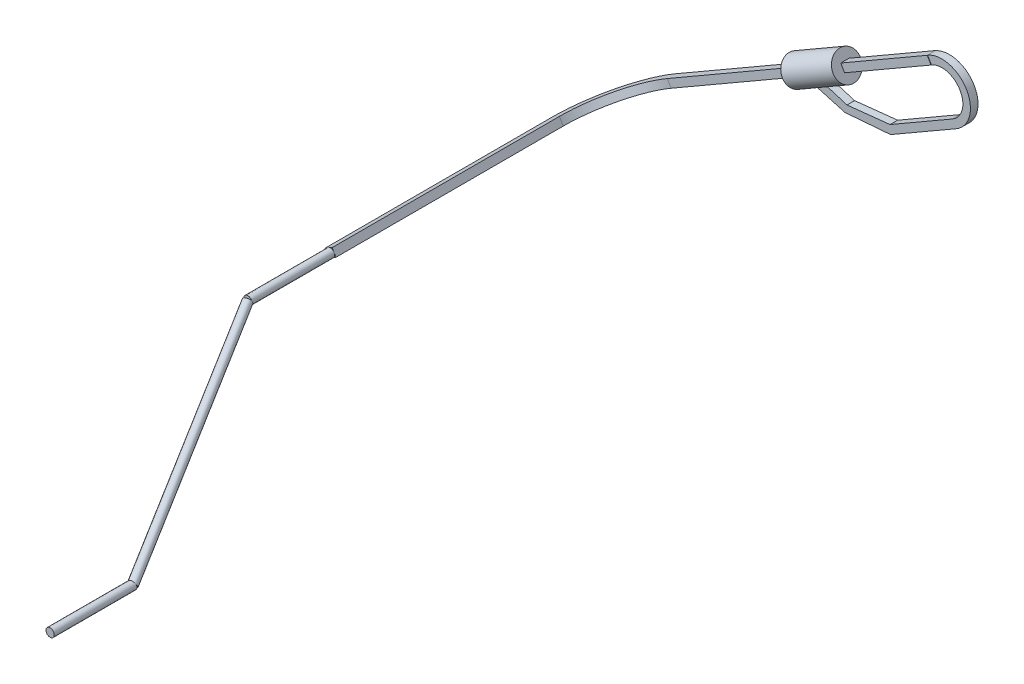
from build123d import *

# Parameters (mm, degrees)
S01_TENDON_CAPTIVE_TAIL_R                      = 0.6
F_01_TENDON_CAPTIVE_TAIL_DEPTH                 = 12
S02_CROSSED_TENDON_R                           = 0.6
F_02_CROSSED_TENDON_DEPTH                      = 33.010681761
S03_TENDON_THROUGH_REAR_GROMMET_R              = 0.6
F_03_TENDON_THROUGH_REAR_GROMMET_DEPTH         = 12
F_04_START                                     = -0.55
F_04_TENDON_RETURN_DEPTH                       = 1.1
F_05_START                                     = 0.55
F_05_REMOVABLE_BACKED_EYE_AROUND_POLISHE_DEPTH = 1.1
S06_DRESSED_EYE_KNOT_ENVELOPE_R                = 2
F_06_DRESSED_EYE_KNOT_ENVELOPE_DEPTH           = 8.5


with BuildPart() as part:
    # S01 - Tendon captive tail → 01 - Tendon captive tail (new body)
    with BuildSketch(Plane.XY.offset(25.959868809)):
        with Locations((9.23492213, 11.820161304)):
            Circle(S01_TENDON_CAPTIVE_TAIL_R)
    extrude(amount=F_01_TENDON_CAPTIVE_TAIL_DEPTH)

    # S02 - Crossed tendon → 02 - Crossed tendon (add)
    with BuildSketch(Plane(origin=(-4.622059485, 9.098971782, -12.992860813), x_dir=(0.9600712579884836, 0.16047626486622726, -0.2291518012126354), z_dir=(0.2797555711409706, -0.5507259385721964, 0.7864081389452696))):
        with Locations(Location((4.814287946, 24.573430328, 0), (0, 0, 21.775546522))):
            Circle(S02_CROSSED_TENDON_R)
    extrude(amount=F_02_CROSSED_TENDON_DEPTH)

    # S03 - Tendon through rear grommet → 03 - Tendon through rear grommet (add)
    with BuildSketch(Plane.XY.offset(-12)):
        with Locations(Location((0, 30, 0), (0, 0, 206.929477468))):
            Circle(S03_TENDON_THROUGH_REAR_GROMMET_R)
    extrude(amount=F_03_TENDON_THROUGH_REAR_GROMMET_DEPTH)

    # S04 - Tendon return → 04 - Tendon return (add)
    with BuildSketch(Plane(origin=(-12.990381057, 22.5, 0), x_dir=(-0.8660254037844386, -0.5000000000000001, 0), z_dir=(0.5000000000000001, -0.8660254037844386, 0)).offset(F_04_START)):
        with BuildLine():
            Line((-14.4, 12), (-14.4, 45))
            ThreePointArc((-14.4, 45), (-17.211774901, 51.788225099), (-24, 54.6))
            Line((-24, 54.6), (-67.598500564, 54.6))
            Line((-67.598500564, 54.6), (-67.598500564, 53.4))
            Line((-67.598500564, 53.4), (-24, 53.4))
            ThreePointArc((-24, 53.4), (-18.060303038, 50.939696962), (-15.6, 45))
            Line((-15.6, 45), (-15.6, 12))
            Line((-15.6, 12), (-14.4, 12))
        make_face()
    extrude(amount=F_04_TENDON_RETURN_DEPTH)

    # S05 - Removable backed eye around polished clevis sleeve → 05 - Removable backed eye around polished clevis sleeve (add)
    with BuildSketch(Plane.XY.offset(-54).offset(F_05_START)):
        with BuildLine():
            Line((45.103432609, 56.675564254), (45.27663769, 56.775564254))
            ThreePointArc((45.27663769, 56.775564254), (50.945643115, 55.256558829), (49.42663769, 49.587553403))
            Line((49.42663769, 49.587553403), (39.900358248, 44.087553403))
            Line((39.900358248, 44.087553403), (33.279205825, 43.555725804))
            Line((33.279205825, 43.555725804), (27.76510421, 45.106429959))
            Line((27.76510421, 45.106429959), (28.231129614, 46.299250282))
            Line((28.231129614, 46.299250282), (33.572026148, 44.648546127))
            Line((33.572026148, 44.648546127), (39.82667222, 45.315181347))
            Line((39.82667222, 45.315181347), (48.87663769, 50.540181347))
            ThreePointArc((48.87663769, 50.540181347), (49.993015171, 54.706558829), (45.82663769, 55.82293631))
            Line((45.82663769, 55.82293631), (45.653432609, 55.72293631))
            Line((45.653432609, 55.72293631), (45.103432609, 56.675564254))
        make_face()
    extrude(amount=-F_05_REMOVABLE_BACKED_EYE_AROUND_POLISHE_DEPTH)

    # S06 - Dressed eye knot envelope → 06 - Dressed eye knot envelope (add)
    with BuildSketch(Plane(origin=(38.623434459, 22.299250282, 0), x_dir=(0, 0, -1), z_dir=(0.8660254037844387, 0.4999999999999999, 0))):
        with Locations(Location((54, 25.980762114, 0), (0, 0, 90))):
            Circle(S06_DRESSED_EYE_KNOT_ENVELOPE_R)
    extrude(amount=F_06_DRESSED_EYE_KNOT_ENVELOPE_DEPTH)


solid = part.part
